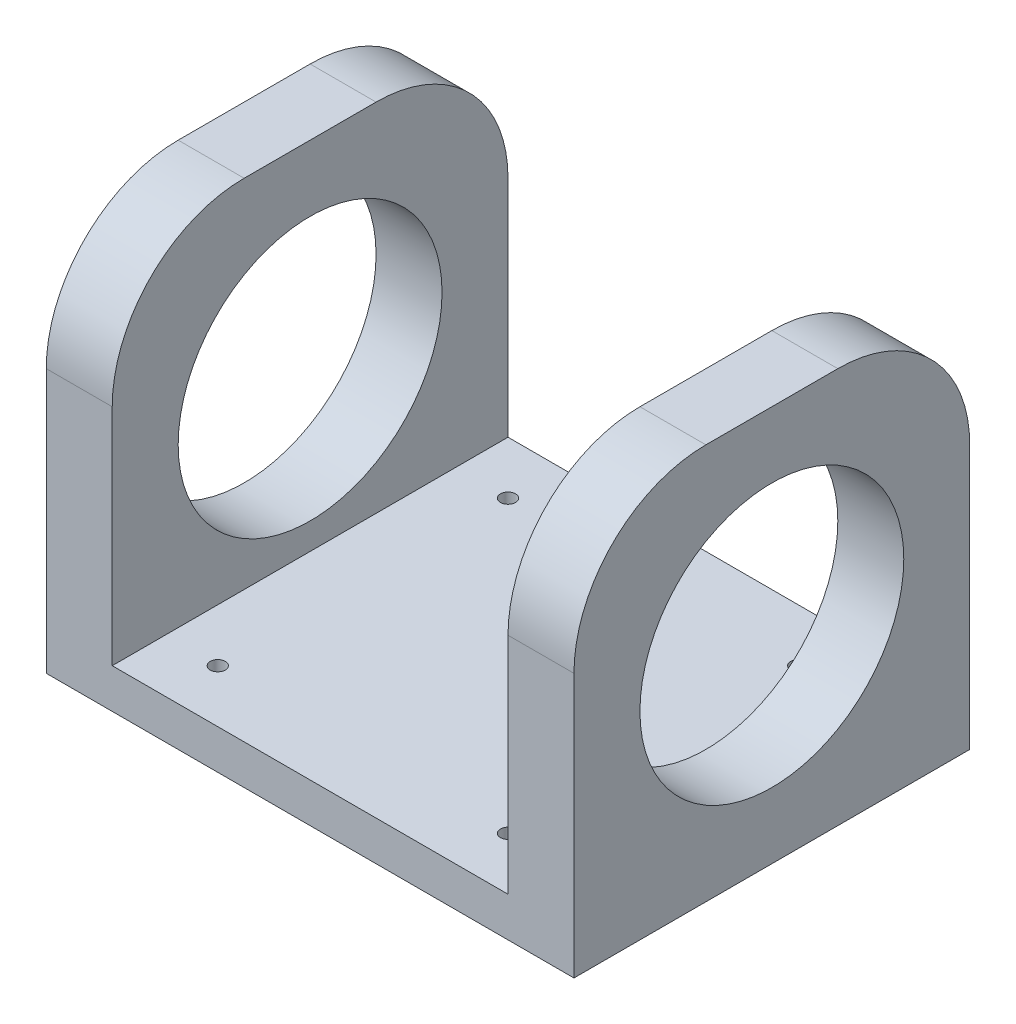
from build123d import *
from build123d.topology import SkipClean

# Parameters (mm, degrees)
SKETCH1_W           = 101.6
SKETCH1_H           = 76.2
BOSS_EXTRUDE1_DEPTH = 30.48
SKETCH2_R           = 25.4
BOSS_EXTRUDE2_DEPTH = 12.7
SKETCH3_W           = 76.2
SKETCH3_H           = 76.2
CUT_EXTRUDE1_DEPTH  = 22.86
SKETCH5_R           = 25.4
CUT_EXTRUDE3_DEPTH  = 256.032
SKETCH6_R           = 1.45
CUT_EXTRUDE4_DEPTH  = 256.032


with BuildPart() as part:
    # Sketch1 → Boss-Extrude1 (new body)
    with BuildSketch(Plane(origin=(0, 0, 0), x_dir=(1, 0, 0), z_dir=(0, 1, 0))):
        Rectangle(SKETCH1_W, SKETCH1_H)
    extrude(amount=-BOSS_EXTRUDE1_DEPTH)

    # Sketch2 → Boss-Extrude2 (add)
    with BuildSketch(Plane.ZY.offset(50.8)):
        with BuildLine():
            Line((-38.1, -30.48), (38.1, -30.48))
            Line((38.1, -30.48), (38.1, 20.32))
            ThreePointArc((38.1, 20.32), (30.660512242, 38.280512242), (12.7, 45.72))
            Line((12.7, 45.72), (-12.7, 45.72))
            ThreePointArc((-12.7, 45.72), (-30.660512242, 38.280512242), (-38.1, 20.32))
            Line((-38.1, 20.32), (-38.1, -30.48))
        make_face()
        with Locations((0, 7.62)):
            Circle(SKETCH2_R, mode=Mode.SUBTRACT)
    boss_extrude2 = extrude(amount=-BOSS_EXTRUDE2_DEPTH)

    # Mirror1: Boss-Extrude2 across plane
    add(boss_extrude2.mirror(Plane(origin=(0, 0, 0), x_dir=(0, 0, 1), z_dir=(1, 0, 0))))

    # Sketch3 → Cut-Extrude1 (cut)
    with BuildSketch(Plane(origin=(0, 0, 0), x_dir=(1, 0, 0), z_dir=(0, 1, 0))):
        Rectangle(SKETCH3_W, SKETCH3_H)
    extrude(amount=-CUT_EXTRUDE1_DEPTH, mode=Mode.SUBTRACT)

    # Sketch5 → Cut-Extrude3 (cut)
    with SkipClean():  # the faces are left unmerged after this step: merging them gives an invalid solid
        with BuildSketch(Plane.ZY.offset(50.8)):
            with Locations((0, 7.62)):
                Circle(SKETCH5_R)
        extrude(amount=-CUT_EXTRUDE3_DEPTH, mode=Mode.SUBTRACT)

    # Sketch6 → Cut-Extrude4 (cut)
    with SkipClean():  # the faces are left unmerged after this step: merging them gives an invalid solid
        with BuildSketch(Plane(origin=(0, -22.86, 0), x_dir=(1, 0, 0), z_dir=(0, 1, 0))):
            with Locations(Location((-27.94, 27.94, 0), (0, 0, 270))):
                Circle(SKETCH6_R)
            with Locations(Location((27.94, 27.94, 0), (0, 0, 90))):
                Circle(SKETCH6_R)
            with Locations(Location((27.94, -27.94, 0), (0, 0, 270))):
                Circle(SKETCH6_R)
            with Locations(Location((-27.94, -27.94, 0), (0, 0, 90))):
                Circle(SKETCH6_R)
        extrude(amount=-CUT_EXTRUDE4_DEPTH, mode=Mode.SUBTRACT)


solid = part.part
